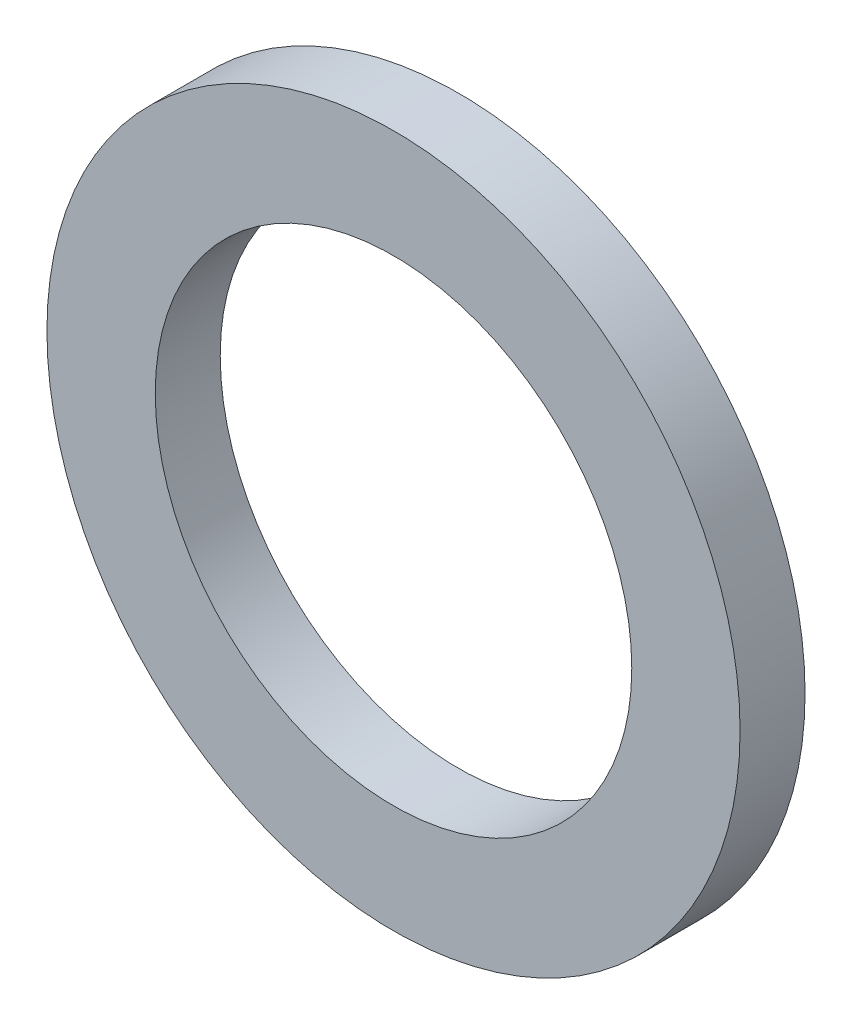
from build123d import *

# Parameters (mm, degrees)
SKETCH1_R      = 8
SKETCH1_R_2    = 5.5
EXTRUDE1_DEPTH = 1.5


with BuildPart() as part:
    # Sketch1 → Extrude1 (new body)
    with BuildSketch(Plane.XY):
        Circle(SKETCH1_R)
        Circle(SKETCH1_R_2, mode=Mode.SUBTRACT)
    extrude(amount=EXTRUDE1_DEPTH)


solid = part.part
